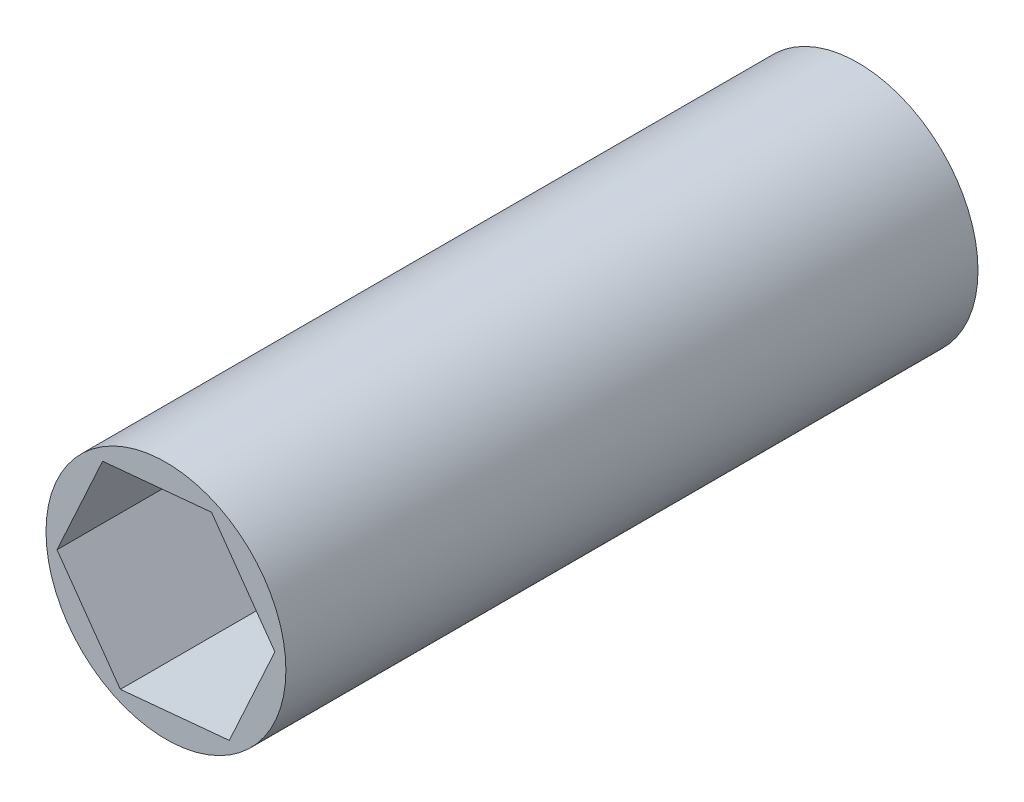
from build123d import *

# Parameters (mm, degrees)
SKETCH1_R           = 6.35
BOSS_EXTRUDE1_DEPTH = 36.6395


with BuildPart() as part:
    # Sketch1 → Boss-Extrude1 (new body)
    with BuildSketch(Plane.XY):
        Circle(SKETCH1_R)
        Polygon((-3.353892255, 4.722827869), (-5.767035039, -0.54314196), (-2.413142785, -5.265969828), (3.353892255, -4.722827869), (5.767035039, 0.54314196), (2.413142785, 5.265969828), align=None, mode=Mode.SUBTRACT)
    extrude(amount=BOSS_EXTRUDE1_DEPTH)


solid = part.part
